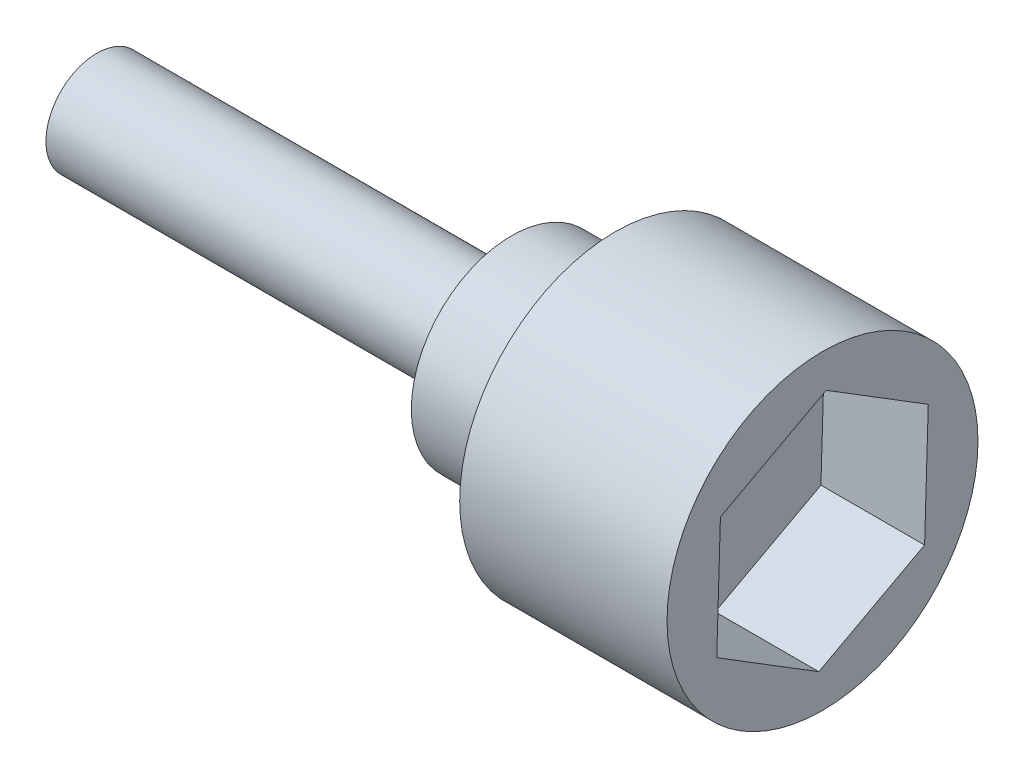
from build123d import *

# Parameters (mm, degrees)
SKETCH1_R           = 0.9834
BOSS_EXTRUDE1_DEPTH = 8
SKETCH2_R           = 1.9334
BOSS_EXTRUDE2_DEPTH = 6
SKETCH3_R           = 3
BOSS_EXTRUDE3_DEPTH = 4
CUT_EXTRUDE1_DEPTH  = 2


with BuildPart() as part:
    # Sketch1 → Boss-Extrude1 (new body)
    with BuildSketch(Plane(origin=(0, 0, 0), x_dir=(0, 0, -1), z_dir=(1, 0, 0))):
        Circle(SKETCH1_R)
    extrude(amount=BOSS_EXTRUDE1_DEPTH)

    # Sketch2 → Boss-Extrude2 (add)
    with BuildSketch(Plane(origin=(8, 0, 0), x_dir=(0, 0, -1), z_dir=(1, 0, 0))):
        Circle(SKETCH2_R)
    extrude(amount=BOSS_EXTRUDE2_DEPTH)

    # Sketch3 → Boss-Extrude3 (add)
    with BuildSketch(Plane(origin=(14, 0, 0), x_dir=(0, 0, -1), z_dir=(1, 0, 0))):
        Circle(SKETCH3_R)
    extrude(amount=-BOSS_EXTRUDE3_DEPTH)

    # Sketch7 → Cut-Extrude1 (cut)
    with BuildSketch(Plane(origin=(14, 0, 0), x_dir=(0, 0, -1), z_dir=(1, 0, 0))):
        Polygon((2.040680279, 1.096176231), (0.071023676, 2.315369078), (-1.969656602, 1.219192847), (-2.040680279, -1.096176231), (-0.071023676, -2.315369078), (1.969656602, -1.219192847), align=None)
    extrude(amount=-CUT_EXTRUDE1_DEPTH, mode=Mode.SUBTRACT)


solid = part.part
